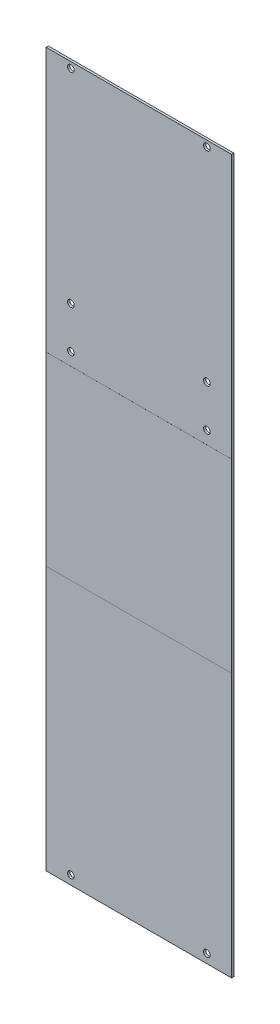
from build123d import *

# Parameters (mm, degrees)
SKETCH1_W                = 83.2
SKETCH1_H                = 320
BOSS_EXTRUDE1_DEPTH      = 1
F_3_0_3_DIAMETER_HOLE1_D = 3
SKETCH_1_W               = 83.2
SKETCH_1_H               = 83.2
EXTRUDE_1_DEPTH          = 0.01


with BuildPart() as part:
    # Sketch1 → Boss-Extrude1 (new body)
    with BuildSketch(Plane.XY):
        Rectangle(SKETCH1_W, SKETCH1_H)
    extrude(amount=BOSS_EXTRUDE1_DEPTH)

    # Ø3.0 (3) Diameter Hole1 (through all)
    with Locations(Plane.XY.offset(1)):
        with Locations((-30.5, 66), (30.5, 66), (30.5, -156), (-30.5, -156), (-30.5, 157.3), (30.5, 157.3), (-30.5, 47.3), (30.5, 47.3)):
            Hole(F_3_0_3_DIAMETER_HOLE1_D / 2)

    # Эскиз1 → Бобышка-Вытянуть1 (add)
    with BuildSketch(Plane.XY.offset(1)):
        Rectangle(SKETCH_1_W, SKETCH_1_H)
    extrude(amount=EXTRUDE_1_DEPTH)


solid = part.part
